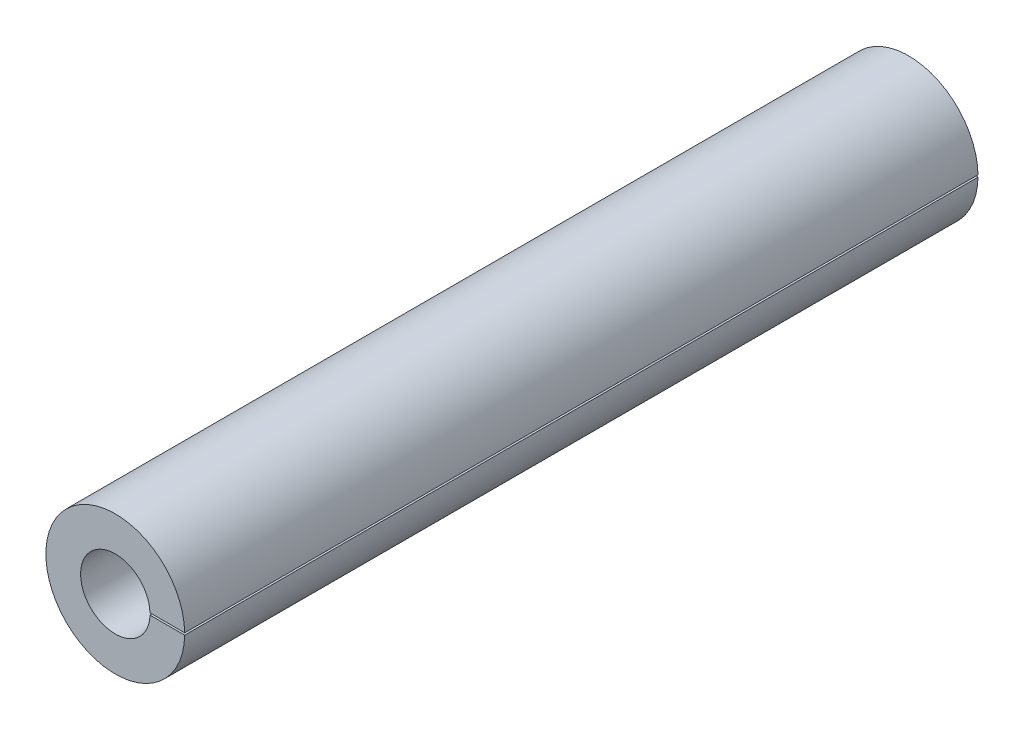
from build123d import *

# Parameters (mm, degrees)
ESQUISSE1_R             = 70
BASE_EXTRUSION_DEPTH    = 800
ESQUISSE2_R             = 35
ENL_V_MAT_EXTRU_1_DEPTH = 800
ESQUISSE3_W             = 70
ESQUISSE3_H             = 2
ENL_V_MAT_EXTRU_2_DEPTH = 800


with BuildPart() as part:
    # Esquisse1 → Base-Extrusion (new body)
    with BuildSketch(Plane.XY):
        Circle(ESQUISSE1_R)
    extrude(amount=BASE_EXTRUSION_DEPTH)

    # Esquisse2 → Enlèv. mat.-Extru.1 (cut)
    with BuildSketch(Plane.XY.offset(800)):
        Circle(ESQUISSE2_R)
    extrude(amount=-ENL_V_MAT_EXTRU_1_DEPTH, mode=Mode.SUBTRACT)

    # Esquisse3 → Enlèv. mat.-Extru.2 (cut)
    with BuildSketch(Plane.XY.offset(800)):
        with Locations((45, 0)):
            Rectangle(ESQUISSE3_W, ESQUISSE3_H)
    extrude(amount=-ENL_V_MAT_EXTRU_2_DEPTH, mode=Mode.SUBTRACT)


solid = part.part
